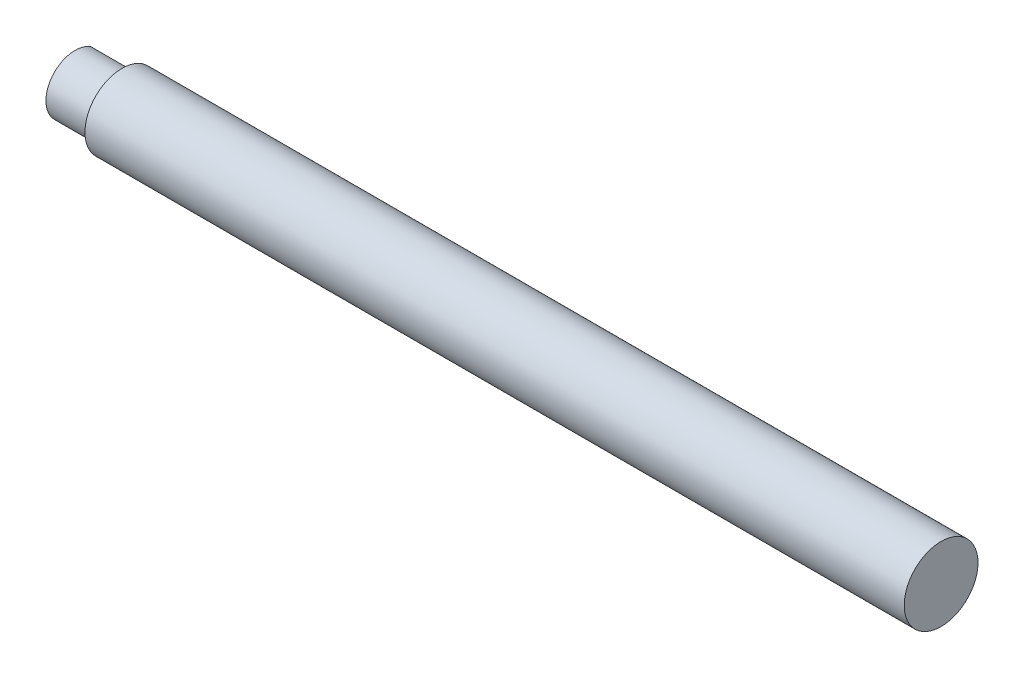
from build123d import *

# Parameters (mm, degrees)
SKETCH1_R          = 2.5
BASE_DEPTH         = 58.674
SKETCH2_OUTSIDE_W  = 18.82
SKETCH2_OUTSIDE_H  = 18.82
CUT_EXTRUDE1_DEPTH = 3.175


with BuildPart() as part:
    # Sketch1 → Base (new body)
    with BuildSketch(Plane(origin=(0, 0, 0), x_dir=(0, 0, -1), z_dir=(1, 0, 0))):
        Circle(SKETCH1_R)
    extrude(amount=BASE_DEPTH)

    # Sketch2 outside → Cut-Extrude1 (cut)
    with BuildSketch(Plane(origin=(0, 0, 0), x_dir=(0, 0, -1), z_dir=(1, 0, 0))):
        Rectangle(SKETCH2_OUTSIDE_W, SKETCH2_OUTSIDE_H)
        with BuildLine():
            Line((1.0795, 1.646108137), (1.0795, -1.646108137))
            ThreePointArc((1.0795, -1.646108137), (-1.9685, 0), (1.0795, 1.646108137))
        make_face(mode=Mode.SUBTRACT)
    extrude(amount=CUT_EXTRUDE1_DEPTH, mode=Mode.SUBTRACT)


solid = part.part
